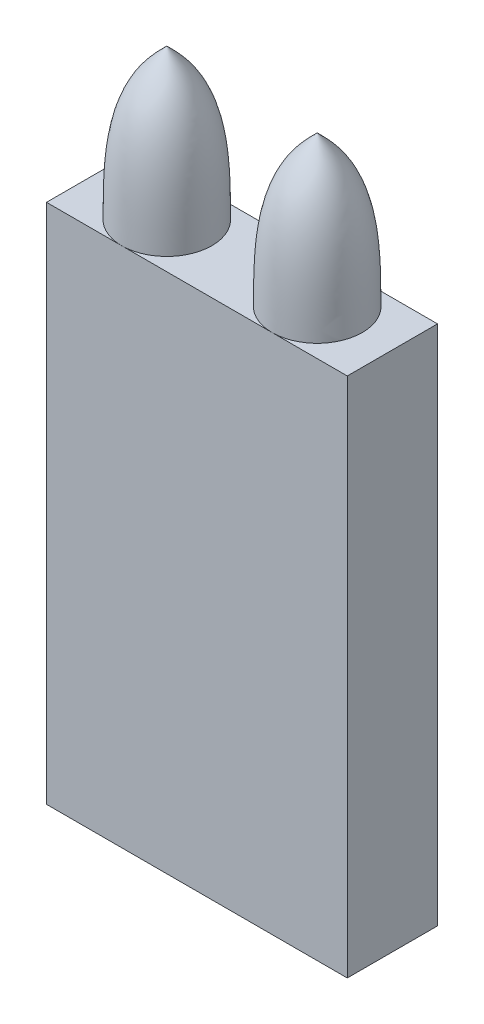
from build123d import *

# Parameters (mm, degrees)
EXTRUSION1_DEPTH        = 3
ESQUISSE4_W             = 20
ESQUISSE4_H             = 34.667192899
EXTRUSION2_DEPTH        = 3
ENL_V_MAT_EXTRU_1_DEPTH = 2


with BuildPart() as part:
    # Esquisse1 → Révolution1 (revolve)
    with BuildSketch(Plane.XY):
        with BuildLine():
            Line((2, -0.332807101), (5, -0.332807101))
            Line((5, -0.332807101), (5, 9.667192899))
            add(Edge.make_bspline(
                [(2, -0.332807101), (2.010323588, 2.856708429), (2.022748068, 6.695303328), (4.569382114, 9.237350604), (5, 9.667192899)],
                knots=[0, 0, 0, 0, 0.830907041, 1, 1, 1, 1], degree=3))
        make_face()
    revolve(axis=Axis((5, 9.667192899, 0), (0, -1, 0)))



with BuildPart() as body_2:
    # Esquisse2 → Révolution2 (revolve)
    with BuildSketch(Plane.XY):
        with BuildLine():
            Line((-5, -0.332807101), (-5, 9.667192899))
            add(Edge.make_bspline(
                [(-2, -0.332807101), (-2.010323588, 2.856708429), (-2.022748068, 6.695303328), (-4.569382114, 9.237350604), (-5, 9.667192899)],
                knots=[0, 0, 0, 0, 0.830907041, 1, 1, 1, 1], degree=3))
            Line((-2, -0.332807101), (-5, -0.332807101))
        make_face()
    revolve(axis=Axis((-5, -0.332807101, 0), (0, 1, 0)))


with BuildPart() as part_1:
    add(part.part)

    add(body_2.part)  # Extrusion1 merges body 2
    # Esquisse3 → Extrusion1 (add)
    with BuildSketch(Plane.XY):
        Polygon((-5, -0.332807101), (-10, -0.332807101), (-10, -35), (10, -35), (10, -0.332807101), (-2, -0.332807101), align=None)
    extrude(amount=EXTRUSION1_DEPTH)

    # Esquisse4 → Extrusion2 (add)
    with BuildSketch(Plane(origin=(0, 0, 0), x_dir=(-1, 0, 0), z_dir=(0, 0, -1))):
        with Locations((0, -17.666403551)):
            Rectangle(ESQUISSE4_W, ESQUISSE4_H)
    extrude(amount=EXTRUSION2_DEPTH)

    # Esquisse5 → Enlèv. mat.-Extru.1 (cut)
    # profile 1 of 7: a face of its own
    with BuildSketch(Plane(origin=(0, 0, -3), x_dir=(-1, 0, 0), z_dir=(0, 0, -1))):
        with BuildLine():
            Line((1.88205707, -4.609056191), (2.028591526, -4.306872698))
            add(Edge.make_bspline(
                [(2.028591526, -4.306872698), (2.0681298, -4.331373463), (2.145487617, -4.379309945), (2.250416066, -4.462110854), (2.344956523, -4.548975923), (2.426413726, -4.643310834), (2.498496553, -4.742379178), (2.560299916, -4.847857267), (2.614073444, -4.958711916), (2.657355003, -5.076502361), (2.691871735, -5.200757444), (2.717268928, -5.332449678), (2.731910041, -5.47227044), (2.733702877, -5.568156321), (2.734621173, -5.617269332)],
                knots=[0, 0, 0, 0, 1.069570816, 2.092647344, 3.070569067, 4.01967349, 4.95558248, 5.886223065, 6.829136365, 7.787158173, 8.769682878, 9.793833117, 10.86999526, 12, 12, 12, 12], degree=3))
            add(Edge.make_bspline(
                [(2.734621173, -5.617269332), (2.733491292, -5.671783429), (2.731292178, -5.777885567), (2.711839409, -5.932507727), (2.68084433, -6.077976458), (2.636290994, -6.214443534), (2.579757917, -6.341928604), (2.509458812, -6.459967838), (2.427453669, -6.569328905), (2.332591272, -6.667321244), (2.23054515, -6.754879138), (2.124917796, -6.832794238), (2.014779553, -6.897174802), (1.902067393, -6.951374489), (1.785611939, -6.992567049), (1.665858567, -7.022086155), (1.543099313, -7.041237242), (1.459818742, -7.043109913), (1.417914442, -7.044052185)],
                knots=[0, 0, 0, 0, 1.205476757, 2.346249306, 3.441406768, 4.491003892, 5.516176455, 6.51984946, 7.52384197, 8.53303875, 9.530058913, 10.495883174, 11.432185487, 12.347937671, 13.258729326, 14.159013425, 15.073670464, 16, 16, 16, 16], degree=3))
            add(Edge.make_bspline(
                [(1.417914442, -7.044052185), (1.378597167, -7.043190644), (1.300588515, -7.041481278), (1.185417428, -7.025321948), (1.073118385, -7.000341878), (0.964345016, -6.964222501), (0.858485576, -6.918716444), (0.756667218, -6.861800599), (0.657022383, -6.796298361), (0.595262065, -6.744828256), (0.563948096, -6.718731672)],
                knots=[0, 0, 0, 0, 1.009393624, 2.002718548, 2.981368972, 3.96092115, 4.942292709, 5.936433579, 6.953722102, 8, 8, 8, 8], degree=3))
            add(Edge.make_bspline(
                [(0.563948096, -6.718731672), (0.525952755, -6.683794863), (0.450918732, -6.614800896), (0.353766595, -6.497790659), (0.271078852, -6.372293283), (0.203425772, -6.237740233), (0.151476958, -6.094315124), (0.114407866, -5.942481408), (0.09152986, -5.782025664), (0.088653882, -5.672033904), (0.087185276, -5.615867089)],
                knots=[0, 0, 0, 0, 0.997027178, 1.968950865, 2.931417886, 3.897315191, 4.873598335, 5.874141366, 6.914439499, 8, 8, 8, 8], degree=3))
            add(Edge.make_bspline(
                [(0.087185276, -5.615867089), (0.088531128, -5.55805062), (0.0911695, -5.44470887), (0.115847552, -5.27936872), (0.154507852, -5.122543072), (0.210653405, -4.975418159), (0.280603382, -4.836324828), (0.368922548, -4.707765343), (0.471111365, -4.586544415), (0.550428965, -4.515381412), (0.590590724, -4.479348659)],
                knots=[0, 0, 0, 0, 1.078704368, 2.114661124, 3.113565113, 4.088377923, 5.048374518, 6.012812246, 6.993805198, 8, 8, 8, 8], degree=3))
            add(Edge.make_bspline(
                [(0.590590724, -4.479348659), (0.620781565, -4.455165531), (0.680844897, -4.407054275), (0.778601978, -4.345133601), (0.881614061, -4.292483258), (0.990407479, -4.249605654), (1.10444175, -4.215870491), (1.224078523, -4.191582403), (1.349246493, -4.175582419), (1.434691553, -4.173379378), (1.478210917, -4.172257313)],
                knots=[0, 0, 0, 0, 0.967473567, 1.924745518, 2.889953502, 3.858752097, 4.846970718, 5.862117206, 6.911121386, 8, 8, 8, 8], degree=3))
            Line((1.478210917, -4.172257313), (1.478210917, -6.685077826))
            add(Edge.make_bspline(
                [(1.478210917, -6.685077826), (1.51191475, -6.683333135), (1.578247376, -6.679899402), (1.67544278, -6.664648075), (1.76761158, -6.639056219), (1.855064667, -6.605389547), (1.937854113, -6.562957175), (2.016020875, -6.511627525), (2.089287228, -6.450652885), (2.157372264, -6.381845306), (2.21899063, -6.306140886), (2.272893269, -6.225586172), (2.319099125, -6.140797294), (2.3561632, -6.051434132), (2.38509156, -5.957768694), (2.405115228, -5.859592401), (2.418220422, -5.757379491), (2.419745704, -5.687656243), (2.420518609, -5.652325422)],
                knots=[0, 0, 0, 0, 1.039073669, 2.045004336, 3.02296125, 3.980111893, 4.926619486, 5.882957722, 6.854402205, 7.857159866, 8.859995037, 9.85624635, 10.83864398, 11.829261994, 12.831114931, 13.853244543, 14.912175862, 16, 16, 16, 16], degree=3))
            add(Edge.make_bspline(
                [(2.420518609, -5.652325422), (2.419892101, -5.617706816), (2.418640001, -5.548520159), (2.407057975, -5.445619293), (2.388210983, -5.344107652), (2.361377653, -5.24545693), (2.329785404, -5.150894642), (2.292696476, -5.062884184), (2.250421202, -4.982468604), (2.202316592, -4.907096468), (2.143485893, -4.834110015), (2.070451647, -4.760744248), (1.982507372, -4.684222392), (1.916761094, -4.63502495), (1.88205707, -4.609056191)],
                knots=[0, 0, 0, 0, 1.015927462, 2.030371344, 3.035493238, 4.043957638, 5.028905753, 5.960363326, 6.844165366, 7.692896148, 8.581107265, 9.590178204, 10.727981024, 12, 12, 12, 12], degree=3))
        make_face()
        with BuildLine():
            add(Edge.make_bspline(
                [(1.164108353, -4.531231672), (1.122409741, -4.543870357), (1.042227853, -4.568173172), (0.931081245, -4.618254241), (0.832187123, -4.674941285), (0.746297664, -4.742505265), (0.671060746, -4.819223967), (0.604467086, -4.907122084), (0.54513787, -5.005776763), (0.494502241, -5.114695846), (0.453571134, -5.230227521), (0.422858807, -5.350009944), (0.405261409, -5.473250595), (0.402618424, -5.556452076), (0.40128784, -5.598339044)],
                knots=[0, 0, 0, 0, 1.104651615, 2.124124779, 3.086357996, 3.990392669, 4.887867225, 5.805973849, 6.782394871, 7.803867138, 8.848693862, 9.888661684, 10.937067484, 12, 12, 12, 12], degree=3))
            add(Edge.make_bspline(
                [(0.40128784, -5.598339044), (0.401897646, -5.632491635), (0.403103956, -5.70005174), (0.414595469, -5.799482813), (0.433286088, -5.895245363), (0.460427641, -5.987005398), (0.493850507, -6.075294278), (0.534685043, -6.160246701), (0.583892646, -6.241025667), (0.621946937, -6.291581536), (0.641071494, -6.316988884)],
                knots=[0, 0, 0, 0, 1.060669213, 2.098198702, 3.104911882, 4.088287873, 5.067258181, 6.03496313, 7.012451476, 8, 8, 8, 8], degree=3))
            add(Edge.make_bspline(
                [(0.641071494, -6.316988884), (0.656143822, -6.33507993), (0.686572171, -6.371602535), (0.739277608, -6.420908966), (0.795796396, -6.468726738), (0.859569632, -6.510767828), (0.927534959, -6.551302021), (1.001522365, -6.587143985), (1.08012954, -6.621716948), (1.135654097, -6.639967758), (1.164108353, -6.649320614)],
                knots=[0, 0, 0, 0, 0.898062514, 1.813028429, 2.750892972, 3.72092503, 4.724711932, 5.770102147, 6.857260878, 8, 8, 8, 8], degree=3))
            Line((1.164108353, -6.649320614), (1.164108353, -4.531231672))
        make_face(mode=Mode.SUBTRACT)
    # profile 2 of 7: a face of its own
    with BuildSketch(Plane(origin=(0, 0, -3), x_dir=(-1, 0, 0), z_dir=(0, 0, -1))):
        with BuildLine():
            Line((0.13205707, -9.251744493), (0.13205707, -8.892770134))
            Line((0.13205707, -8.892770134), (0.508559474, -8.892770134))
            add(Edge.make_bspline(
                [(0.508559474, -8.892770134), (0.473462064, -8.86724118), (0.406105942, -8.81824807), (0.316979215, -8.737208068), (0.243522785, -8.653723678), (0.184986047, -8.568015569), (0.141045779, -8.480110681), (0.109965932, -8.39056821), (0.090953103, -8.299017491), (0.088443476, -8.237309288), (0.087185276, -8.206371897)],
                knots=[0, 0, 0, 0, 1.240090001, 2.379880825, 3.435825918, 4.412439249, 5.338731203, 6.236759833, 7.116000016, 8, 8, 8, 8], degree=3))
            add(Edge.make_bspline(
                [(0.087185276, -8.206371897), (0.088382944, -8.182451734), (0.090850311, -8.1331728), (0.107928294, -8.058446223), (0.135317828, -7.981384586), (0.161331522, -7.931478321), (0.1748255, -7.905590647)],
                knots=[0, 0, 0, 0, 0.906785846, 1.868107758, 2.894132143, 4, 4, 4, 4], degree=3))
            Line((0.1748255, -7.905590647), (0.446860756, -8.092790166))
            add(Edge.make_bspline(
                [(0.446860756, -8.092790166), (0.440127235, -8.109544796), (0.42735683, -8.14132065), (0.412083476, -8.187690861), (0.403287287, -8.230342591), (0.401922961, -8.257521601), (0.40128784, -8.27017398)],
                knots=[0, 0, 0, 0, 1.175706723, 2.229776724, 3.175925307, 4, 4, 4, 4], degree=3))
            add(Edge.make_bspline(
                [(0.40128784, -8.27017398), (0.402941007, -8.297942223), (0.40630037, -8.354369438), (0.433307345, -8.437226321), (0.475411105, -8.518641505), (0.524330118, -8.582485638), (0.570588839, -8.632417062), (0.612096469, -8.667305538), (0.65700705, -8.701177363), (0.707700495, -8.730849674), (0.761644911, -8.760370004), (0.821374547, -8.785579836), (0.885161587, -8.809679237), (0.929617701, -8.823365766), (0.95236957, -8.830370294)],
                knots=[0, 0, 0, 0, 1.183164879, 2.404282402, 3.684748724, 5.08130077, 5.822236575, 6.586118212, 7.392150472, 8.220166419, 9.090371106, 10.015126268, 10.984176003, 12, 12, 12, 12], degree=3))
            add(Edge.make_bspline(
                [(0.95236957, -8.830370294), (0.972637317, -8.835581889), (1.017699976, -8.847169181), (1.093071363, -8.858768449), (1.182187828, -8.869141001), (1.284797412, -8.87840728), (1.401751288, -8.884109003), (1.532168701, -8.888924741), (1.67660614, -8.89282459), (1.777353304, -8.892788864), (1.830174058, -8.892770134)],
                knots=[0, 0, 0, 0, 0.569198417, 1.265537535, 2.072538121, 3.011085978, 4.068372936, 5.258499352, 6.562658, 8, 8, 8, 8], degree=3))
            Line((1.830174058, -8.892770134), (2.689749378, -8.892770134))
            Line((2.689749378, -8.892770134), (2.689749378, -9.251744493))
            Line((2.689749378, -9.251744493), (0.13205707, -9.251744493))
        make_face()
    # profile 3 of 7: a face of its own
    with BuildSketch(Plane(origin=(0, 0, -3), x_dir=(-1, 0, 0), z_dir=(0, 0, -1))):
        with BuildLine():
            Line((0.13205707, -12.985077826), (0.13205707, -12.626103467))
            Line((0.13205707, -12.626103467), (1.318355147, -12.626103467))
            add(Edge.make_bspline(
                [(1.318355147, -12.626103467), (1.353181138, -12.626077993), (1.41980764, -12.626029259), (1.515616277, -12.622669297), (1.603074371, -12.619698798), (1.682150909, -12.614361733), (1.752655554, -12.606144412), (1.814802991, -12.598486468), (1.868653754, -12.588009158), (1.901265126, -12.579072405), (1.916412038, -12.574921576)],
                knots=[0, 0, 0, 0, 1.388489964, 2.656355995, 3.822101815, 4.877729551, 5.815201774, 6.652054204, 7.373923399, 8, 8, 8, 8], degree=3))
            add(Edge.make_bspline(
                [(1.916412038, -12.574921576), (1.935491961, -12.568282859), (1.973442237, -12.555078344), (2.027274264, -12.528849252), (2.07813281, -12.498525025), (2.125943295, -12.463991951), (2.170982591, -12.425522929), (2.212400227, -12.382273657), (2.251373588, -12.335285188), (2.297802599, -12.265678552), (2.347669345, -12.170466286), (2.390245869, -12.045701226), (2.416122945, -11.910385795), (2.419022035, -11.816894017), (2.420518609, -11.768631512)],
                knots=[0, 0, 0, 0, 0.713237362, 1.418640674, 2.111118503, 2.803202376, 3.499999032, 4.200747446, 4.916513603, 5.65395606, 7.153437646, 8.699331164, 10.2961224, 12, 12, 12, 12], degree=3))
            add(Edge.make_bspline(
                [(2.420518609, -11.768631512), (2.418945318, -11.720615715), (2.415899388, -11.627655972), (2.391283959, -11.493912268), (2.349579699, -11.371551559), (2.292172146, -11.261495533), (2.221426021, -11.164690385), (2.138458626, -11.084140193), (2.045627033, -11.018126954), (1.976422419, -10.988929828), (1.941652423, -10.974260518)],
                knots=[0, 0, 0, 0, 1.164572994, 2.25464146, 3.285868583, 4.290364298, 5.255624302, 6.182035225, 7.08661253, 8, 8, 8, 8], degree=3))
            add(Edge.make_bspline(
                [(1.941652423, -10.974260518), (1.927701798, -10.969778754), (1.89693587, -10.959894923), (1.844408964, -10.950201565), (1.781972498, -10.941141857), (1.709007174, -10.933450976), (1.625728145, -10.928249471), (1.532229647, -10.924092036), (1.428683499, -10.921135818), (1.356217972, -10.921030362), (1.318355147, -10.920975262)],
                knots=[0, 0, 0, 0, 0.559844265, 1.234649207, 2.038502869, 2.973158959, 4.039089416, 5.228949391, 6.552141825, 8, 8, 8, 8], degree=3))
            Line((1.318355147, -10.920975262), (0.13205707, -10.920975262))
            Line((0.13205707, -10.920975262), (0.13205707, -10.562000903))
            Line((0.13205707, -10.562000903), (1.377249378, -10.562000903))
            add(Edge.make_bspline(
                [(1.377249378, -10.562000903), (1.419558633, -10.562378929), (1.501656047, -10.563112454), (1.620944658, -10.569488372), (1.732309904, -10.579786319), (1.835564016, -10.594251122), (1.930284334, -10.613303618), (2.017235257, -10.635228191), (2.095942103, -10.662683628), (2.167557144, -10.694240043), (2.232579828, -10.730944399), (2.294299635, -10.76994152), (2.351371002, -10.814532667), (2.406089431, -10.861932163), (2.455653698, -10.915266617), (2.502666049, -10.971613566), (2.54578974, -11.032561727), (2.585000661, -11.097668535), (2.620031425, -11.167319205), (2.651037137, -11.241004104), (2.676822408, -11.318879961), (2.697941225, -11.401129243), (2.714640008, -11.487515906), (2.726466986, -11.578357948), (2.733627533, -11.67316161), (2.734285467, -11.737769295), (2.734621173, -11.770734877)],
                knots=[0, 0, 0, 0, 1.455489344, 2.824249936, 4.108329657, 5.302249325, 6.409182103, 7.431056236, 8.384600105, 9.273623122, 10.119381909, 10.951268541, 11.782688782, 12.608648331, 13.439018233, 14.28420356, 15.13194734, 16.004789275, 16.896534964, 17.811891032, 18.752637364, 19.715994979, 20.73149136, 21.777654197, 22.866064894, 24, 24, 24, 24], degree=3))
            add(Edge.make_bspline(
                [(2.734621173, -11.770734877), (2.734296303, -11.803935241), (2.733661799, -11.868778746), (2.726386693, -11.964034104), (2.714827472, -12.054922311), (2.697637784, -12.141673762), (2.676939326, -12.224475971), (2.651192232, -12.303096199), (2.61982851, -12.377087721), (2.585214715, -12.447180137), (2.545468087, -12.512831346), (2.502251652, -12.574123173), (2.455732123, -12.631601942), (2.405059642, -12.684355247), (2.350254799, -12.732667856), (2.291923375, -12.776993329), (2.230008822, -12.816990329), (2.163973919, -12.853407529), (2.091700589, -12.885477048), (2.010908917, -12.911565322), (1.922292036, -12.934870784), (1.824694553, -12.952548558), (1.719228636, -12.967320814), (1.605047723, -12.97762796), (1.482490654, -12.983970038), (1.397823866, -12.984700635), (1.354112359, -12.985077826)],
                knots=[0, 0, 0, 0, 1.127311838, 2.201748491, 3.242349228, 4.23701642, 5.203382164, 6.139583413, 7.043187276, 7.930575844, 8.79221141, 9.646615004, 10.475912738, 11.301098226, 12.127656736, 12.954710499, 13.786889854, 14.628740568, 15.513605364, 16.467372646, 17.508850825, 18.623433476, 19.833461899, 21.124763205, 22.515581664, 24, 24, 24, 24], degree=3))
            Line((1.354112359, -12.985077826), (0.13205707, -12.985077826))
        make_face()
    # profile 4 of 7: a face of its own
    with BuildSketch(Plane(origin=(0, 0, -3), x_dir=(-1, 0, 0), z_dir=(0, 0, -1))):
        Polygon((-0.899994212, -15.058154749), (-0.899994212, -14.69918039), (0.13205707, -14.69918039), (0.13205707, -14.205590647), (0.446159635, -14.205590647), (0.446159635, -14.69918039), (2.689749378, -14.69918039), (2.689749378, -15.058154749), (0.446159635, -15.058154749), (0.446159635, -15.551744493), (0.13205707, -15.551744493), (0.13205707, -15.058154749), align=None)
    # profile 5 of 7: a face of its own
    with BuildSketch(Plane(origin=(0, 0, -3), x_dir=(-1, 0, 0), z_dir=(0, 0, -1))):
        with BuildLine():
            Line((0.13205707, -19.59918039), (0.13205707, -19.240206031))
            Line((0.13205707, -19.240206031), (0.605314282, -19.240206031))
            add(Edge.make_bspline(
                [(0.605314282, -19.240206031), (0.56259977, -19.204227131), (0.478848043, -19.133682134), (0.370497437, -19.013739127), (0.280619158, -18.885720489), (0.20803034, -18.750001006), (0.154609271, -18.60550218), (0.114804482, -18.453922135), (0.091476677, -18.293948428), (0.088633713, -18.184625834), (0.087185276, -18.128927986)],
                knots=[0, 0, 0, 0, 1.052649639, 2.063964259, 3.038813347, 3.997354988, 4.95870115, 5.938234768, 6.949568608, 8, 8, 8, 8], degree=3))
            add(Edge.make_bspline(
                [(0.087185276, -18.128927986), (0.088495318, -18.08003455), (0.091080006, -17.983568807), (0.108605694, -17.841728218), (0.13876178, -17.705257957), (0.182154548, -17.574598322), (0.235590372, -17.448425762), (0.303226698, -17.328688478), (0.381822509, -17.213990142), (0.471845954, -17.106378354), (0.569563196, -17.007183399), (0.674299756, -16.920752625), (0.783733814, -16.847243081), (0.897739474, -16.786063365), (1.017540143, -16.739894372), (1.142145659, -16.706954846), (1.27135048, -16.685678393), (1.359404195, -16.683575951), (1.403892006, -16.682513723)],
                knots=[0, 0, 0, 0, 1.079831048, 2.130484411, 3.151152415, 4.161574847, 5.167411663, 6.172652272, 7.193516047, 8.234449481, 9.267404425, 10.26472832, 11.228230131, 12.174979933, 13.116310661, 14.056636003, 15.018144646, 16, 16, 16, 16], degree=3))
            add(Edge.make_bspline(
                [(1.403892006, -16.682513723), (1.449303842, -16.68364121), (1.538929365, -16.685866436), (1.670570815, -16.706075754), (1.797085117, -16.738999782), (1.918194055, -16.785792628), (2.034562117, -16.844742497), (2.145188858, -16.917561245), (2.25013397, -17.00388485), (2.348571984, -17.102100958), (2.438990555, -17.208822956), (2.51837684, -17.322537598), (2.584862855, -17.442042311), (2.640224809, -17.566691122), (2.682092816, -17.697017368), (2.71235769, -17.832633928), (2.730944277, -17.97369931), (2.733384612, -18.069743759), (2.734621173, -18.118411159)],
                knots=[0, 0, 0, 0, 1.000386672, 1.974379078, 2.927679124, 3.87665516, 4.830386529, 5.797612976, 6.789582816, 7.820380598, 8.858501418, 9.868759178, 10.871900501, 11.868247445, 12.870065362, 13.883574667, 14.927570307, 16, 16, 16, 16], degree=3))
            add(Edge.make_bspline(
                [(2.734621173, -18.118411159), (2.73324635, -18.173188592), (2.730541852, -18.280944639), (2.705981212, -18.438939881), (2.666031896, -18.590165347), (2.609549834, -18.734450936), (2.537547181, -18.872345616), (2.449210477, -19.002932048), (2.346003029, -19.127440087), (2.266636176, -19.202212353), (2.226307872, -19.240206031)],
                knots=[0, 0, 0, 0, 1.033846792, 2.033743403, 3.011111982, 3.982283235, 4.953494596, 5.942511426, 6.954538061, 8, 8, 8, 8], degree=3))
            Line((2.226307872, -19.240206031), (3.63205707, -19.240206031))
            Line((3.63205707, -19.240206031), (3.63205707, -19.59918039))
            Line((3.63205707, -19.59918039), (0.13205707, -19.59918039))
        make_face()
        with BuildLine():
            add(Edge.make_bspline(
                [(0.40128784, -18.1422493), (0.401920936, -18.180163007), (0.403164377, -18.254627847), (0.41816442, -18.363825493), (0.439911553, -18.468975244), (0.472633901, -18.569240634), (0.513210316, -18.665215064), (0.563351625, -18.756476069), (0.623496749, -18.842556201), (0.690669975, -18.924312068), (0.76538758, -18.997981781), (0.844668595, -19.063403895), (0.929651081, -19.117231584), (1.018020723, -19.162841839), (1.111693265, -19.197022996), (1.209250797, -19.222564484), (1.311587608, -19.237442274), (1.381175041, -19.239275236), (1.416512199, -19.240206031)],
                knots=[0, 0, 0, 0, 1.089869178, 2.140569769, 3.165134853, 4.175037148, 5.169038028, 6.158983698, 7.164153224, 8.185913181, 9.198497231, 10.178139172, 11.136700046, 12.086806939, 13.033410836, 13.998737774, 14.983740093, 16, 16, 16, 16], degree=3))
            add(Edge.make_bspline(
                [(1.416512199, -19.240206031), (1.462905925, -19.238409598), (1.553869434, -19.234887357), (1.686713366, -19.208427314), (1.812003696, -19.163789612), (1.929596915, -19.101739627), (2.037969158, -19.023339794), (2.133932601, -18.927825938), (2.218905741, -18.818221397), (2.290121265, -18.694516582), (2.347712104, -18.561758222), (2.390417714, -18.423656127), (2.415513545, -18.281519101), (2.418843966, -18.185581823), (2.420518609, -18.137341448)],
                knots=[0, 0, 0, 0, 1.004072475, 1.968670389, 2.919364618, 3.874559533, 4.83812163, 5.804231433, 6.796142524, 7.832404746, 8.886210388, 9.923435828, 10.95583619, 12, 12, 12, 12], degree=3))
            add(Edge.make_bspline(
                [(2.420518609, -18.137341448), (2.418929759, -18.090016502), (2.4157685, -17.995856285), (2.389515827, -17.857447565), (2.348048632, -17.723047652), (2.289013899, -17.59499083), (2.216233253, -17.47453585), (2.12830504, -17.365960483), (2.02668994, -17.270888088), (1.913296692, -17.190041737), (1.792601308, -17.124307497), (1.666911558, -17.076856335), (1.538329628, -17.046360349), (1.451033254, -17.04311186), (1.407397615, -17.041488082)],
                knots=[0, 0, 0, 0, 1.02979818, 2.048940961, 3.056544965, 4.085890364, 5.111416942, 6.113647569, 7.118149602, 8.132133424, 9.138580134, 10.101713523, 11.051129621, 12, 12, 12, 12], degree=3))
            add(Edge.make_bspline(
                [(1.407397615, -17.041488082), (1.363540471, -17.043163591), (1.276085312, -17.046504708), (1.146901569, -17.076072737), (1.021453783, -17.12328829), (0.901484513, -17.188632358), (0.789505234, -17.268809631), (0.689206849, -17.363147809), (0.602897547, -17.471300872), (0.530271669, -17.590735775), (0.473037839, -17.71978067), (0.431210728, -17.855483709), (0.406210367, -17.99713076), (0.402940106, -18.093539687), (0.40128784, -18.1422493)],
                knots=[0, 0, 0, 0, 0.952525979, 1.899423946, 2.865876581, 3.859467237, 4.860720726, 5.852841987, 6.843244024, 7.860259403, 8.883892529, 9.904557406, 10.941299304, 12, 12, 12, 12], degree=3))
        make_face(mode=Mode.SUBTRACT)
    # profile 6 of 7: a face of its own
    with BuildSketch(Plane(origin=(0, 0, -3), x_dir=(-1, 0, 0), z_dir=(0, 0, -1))):
        with BuildLine():
            Line((0.13205707, -21.044052185), (2.689749378, -21.044052185))
            Line((2.689749378, -21.044052185), (2.689749378, -21.403026544))
            Line((2.689749378, -21.403026544), (2.247341526, -21.403026544))
            add(Edge.make_bspline(
                [(2.247341526, -21.403026544), (2.287467278, -21.440990709), (2.366466997, -21.515734689), (2.468181667, -21.64022883), (2.552464364, -21.771965611), (2.620186258, -21.910061208), (2.671605348, -22.055119862), (2.70757483, -22.206525707), (2.731151802, -22.364227076), (2.733453129, -22.471683774), (2.734621173, -22.526223659)],
                knots=[0, 0, 0, 0, 1.048315161, 2.063926512, 3.044028115, 4.012756489, 4.978653777, 5.96048261, 6.964838411, 8, 8, 8, 8], degree=3))
            add(Edge.make_bspline(
                [(2.734621173, -22.526223659), (2.73340509, -22.574894502), (2.731010961, -22.670713911), (2.71216779, -22.811728692), (2.6823477, -22.9472206), (2.640052841, -23.077421817), (2.58488262, -23.20189564), (2.518380004, -23.321403541), (2.43895733, -23.435076026), (2.348811505, -23.541841871), (2.249886848, -23.63933116), (2.145219662, -23.725702442), (2.034554077, -23.798481957), (1.918196184, -23.857442097), (1.797084546, -23.904232216), (1.670570971, -23.937156979), (1.538929325, -23.957366097), (1.449303829, -23.959591351), (1.403892006, -23.960718852)],
                knots=[0, 0, 0, 0, 1.073006613, 2.112452808, 3.131537238, 4.128992884, 5.125875819, 6.129556788, 7.140358021, 8.179037306, 9.206764687, 10.199268163, 11.167014935, 12.12125937, 13.070745913, 14.024558793, 14.999075164, 16, 16, 16, 16], degree=3))
            add(Edge.make_bspline(
                [(1.403892006, -23.960718852), (1.359403541, -23.959657861), (1.271348533, -23.957557866), (1.142153189, -23.936263481), (1.017512566, -23.903390383), (0.897944822, -23.857013085), (0.783533331, -23.796837524), (0.674330446, -23.72312283), (0.569554939, -23.636766579), (0.471846601, -23.537551572), (0.381828378, -23.429941951), (0.303203294, -23.315255041), (0.235782426, -23.195658067), (0.181988966, -23.069875122), (0.138782801, -22.939365953), (0.108671258, -22.803133962), (0.091038879, -22.661538663), (0.088483556, -22.565302561), (0.087185276, -22.516407954)],
                knots=[0, 0, 0, 0, 0.982608992, 1.944855656, 2.885902759, 3.827956019, 4.773021323, 5.737262684, 6.73535209, 7.769099895, 8.810832312, 9.832479667, 10.838491863, 11.840357401, 12.851555398, 13.873006831, 14.919340111, 16, 16, 16, 16], degree=3))
            add(Edge.make_bspline(
                [(0.087185276, -22.516407954), (0.088615347, -22.460239887), (0.091416704, -22.350212685), (0.114936785, -22.189122362), (0.15432441, -22.036714335), (0.208226825, -21.891688141), (0.280451734, -21.755575726), (0.370100972, -21.627487362), (0.479147859, -21.508849987), (0.562649975, -21.43881169), (0.605314282, -21.403026544)],
                knots=[0, 0, 0, 0, 1.057102752, 2.070750592, 3.056826284, 4.016232894, 4.976728547, 5.94961084, 6.952380656, 8, 8, 8, 8], degree=3))
            Line((0.605314282, -21.403026544), (0.13205707, -21.403026544))
            Line((0.13205707, -21.403026544), (0.13205707, -21.044052185))
        make_face()
        with BuildLine():
            add(Edge.make_bspline(
                [(0.40128784, -22.500983275), (0.40294012, -22.549692868), (0.406210411, -22.646101757), (0.431210557, -22.78774909), (0.473038468, -22.923451079), (0.530269316, -23.052499887), (0.602906167, -23.171920392), (0.689175584, -23.28012579), (0.789722824, -23.374362651), (0.901270359, -23.455333965), (1.021323914, -23.520799868), (1.147054341, -23.566973868), (1.276067176, -23.596778902), (1.363534413, -23.600086029), (1.407397615, -23.601744493)],
                knots=[0, 0, 0, 0, 1.058595202, 2.095233796, 3.115796969, 4.139328096, 5.156242136, 6.146545486, 7.138567887, 8.142695509, 9.13618716, 10.10076532, 11.047568934, 12, 12, 12, 12], degree=3))
            add(Edge.make_bspline(
                [(1.407397615, -23.601744493), (1.451039331, -23.600137713), (1.538347863, -23.59692323), (1.666757759, -23.566190095), (1.792733467, -23.519784378), (1.913511737, -23.453925165), (2.026465809, -23.37227924), (2.128361682, -23.277329363), (2.216003208, -23.168779879), (2.289186819, -23.048828151), (2.348333623, -22.920498717), (2.389279275, -22.785479945), (2.415897499, -22.64622588), (2.418967893, -22.551586044), (2.420518609, -22.503787762)],
                knots=[0, 0, 0, 0, 0.94754999, 1.89564494, 2.855650757, 3.860696959, 4.87623684, 5.879341071, 6.880177056, 7.899942424, 8.92785545, 9.943764016, 10.961488621, 12, 12, 12, 12], degree=3))
            add(Edge.make_bspline(
                [(2.420518609, -22.503787762), (2.418839401, -22.455548516), (2.415499903, -22.359613483), (2.390510555, -22.217680581), (2.347718107, -22.080050696), (2.289953672, -21.947853093), (2.218893554, -21.824329267), (2.134132781, -21.714741326), (2.037932739, -21.619859868), (1.929412385, -21.542196613), (1.811873425, -21.480303591), (1.686866083, -21.434604391), (1.553849693, -21.408402197), (1.462899257, -21.404842222), (1.416512199, -21.403026544)],
                knots=[0, 0, 0, 0, 1.045407845, 2.079038228, 3.112656195, 4.163072846, 5.20056969, 6.193662562, 7.157374447, 8.119113477, 9.075446429, 10.028984102, 10.994731255, 12, 12, 12, 12], degree=3))
            add(Edge.make_bspline(
                [(1.416512199, -21.403026544), (1.381174839, -21.403957029), (1.311587007, -21.40578938), (1.209253094, -21.420671613), (1.111684904, -21.446196756), (1.018051333, -21.480437682), (0.929422786, -21.525882249), (0.844896977, -21.580644684), (0.765321992, -21.64587294), (0.690928899, -21.719610736), (0.62326306, -21.800713348), (0.563385882, -21.886785456), (0.51320116, -21.978009773), (0.472636401, -22.073994054), (0.439910868, -22.174256752), (0.418164609, -22.279407242), (0.403164327, -22.388604686), (0.40192092, -22.463069554), (0.40128784, -22.500983275)],
                knots=[0, 0, 0, 0, 1.016356408, 2.00145226, 2.966870863, 3.913564647, 4.863761759, 5.826061372, 6.805796337, 7.818476539, 8.835166489, 9.840431463, 10.830471135, 11.824566403, 12.834564595, 13.859226969, 14.910027331, 16, 16, 16, 16], degree=3))
        make_face(mode=Mode.SUBTRACT)
    # profile 7 of 7: a face of its own
    with BuildSketch(Plane(origin=(0, 0, -3), x_dir=(-1, 0, 0), z_dir=(0, 0, -1))):
        with BuildLine():
            Line((-0.168023058, -25.181231672), (0.042313481, -25.479208435))
            add(Edge.make_bspline(
                [(0.042313481, -25.479208435), (0.018920036, -25.499730921), (-0.027709905, -25.540638206), (-0.092925216, -25.606812984), (-0.153531766, -25.676248699), (-0.211030662, -25.747697879), (-0.262702906, -25.823392086), (-0.311273672, -25.901446649), (-0.354568893, -25.983176723), (-0.394115058, -26.067233191), (-0.428209553, -26.154303797), (-0.458182391, -26.243263473), (-0.484820495, -26.334013769), (-0.504567522, -26.427428143), (-0.520801117, -26.522852639), (-0.53278099, -26.620387622), (-0.539979532, -26.720083417), (-0.54067093, -26.787256082), (-0.541019853, -26.82115555)],
                knots=[0, 0, 0, 0, 0.987893886, 1.969159884, 2.947193632, 3.913758184, 4.879182583, 5.855384673, 6.831445725, 7.814141752, 8.803567409, 9.798570934, 10.794459596, 11.804623025, 12.828189998, 13.867374661, 14.923745782, 16, 16, 16, 16], degree=3))
            add(Edge.make_bspline(
                [(-0.541019853, -26.82115555), (-0.540616961, -26.858340209), (-0.539817316, -26.932142963), (-0.529283814, -27.041409607), (-0.514101851, -27.148666723), (-0.492413278, -27.253839381), (-0.464055734, -27.356929686), (-0.430800129, -27.458410609), (-0.389603215, -27.557091859), (-0.343723951, -27.653757123), (-0.292073411, -27.746415004), (-0.235971794, -27.834285405), (-0.175611201, -27.916549339), (-0.110808046, -27.99324443), (-0.041920182, -28.064853042), (0.030672898, -28.131738393), (0.108502555, -28.192009938), (0.189451574, -28.247549607), (0.274418049, -28.296536267), (0.362267701, -28.339391138), (0.452799697, -28.376157909), (0.546260526, -28.405272334), (0.641724183, -28.428771342), (0.739973229, -28.444671934), (0.840680672, -28.454745891), (0.908876089, -28.456159875), (0.943254987, -28.456872698)],
                knots=[0, 0, 0, 0, 1.086665301, 2.156773686, 3.206091023, 4.252579737, 5.293432989, 6.330489748, 7.372149932, 8.417277294, 9.457143444, 10.471099767, 11.463182959, 12.437701567, 13.404115379, 14.366487576, 15.320456103, 16.279329637, 17.234398489, 18.184690068, 19.134957086, 20.087873006, 21.044016506, 22.006606947, 22.995084137, 24, 24, 24, 24], degree=3))
            add(Edge.make_bspline(
                [(0.943254987, -28.456872698), (0.99499839, -28.455722605), (1.096657695, -28.453463038), (1.245491321, -28.429777596), (1.388233981, -28.393961436), (1.523922097, -28.341471186), (1.65330446, -28.275164956), (1.776148651, -28.193940454), (1.891799275, -28.097322487), (1.999961619, -27.987607574), (2.098465504, -27.866808182), (2.184950278, -27.737115723), (2.257623834, -27.59905526), (2.317215317, -27.453733169), (2.363777207, -27.300684882), (2.396233752, -27.139852108), (2.417437557, -26.971528755), (2.419479944, -26.85651123), (2.420518609, -26.798018531)],
                knots=[0, 0, 0, 0, 0.99976017, 1.964210274, 2.906846164, 3.840961381, 4.770693628, 5.713253685, 6.682446088, 7.679475408, 8.688072431, 9.692042094, 10.688661653, 11.699927997, 12.724944829, 13.776981813, 14.869473725, 16, 16, 16, 16], degree=3))
            add(Edge.make_bspline(
                [(2.420518609, -26.798018531), (2.418825112, -26.733649441), (2.415490048, -26.606885064), (2.387398829, -26.420987492), (2.341881974, -26.243020111), (2.277646093, -26.073042661), (2.195289861, -25.910936264), (2.094140098, -25.757440703), (1.975229894, -25.611666168), (1.883724373, -25.523864021), (1.837185276, -25.479208435)],
                knots=[0, 0, 0, 0, 1.038396361, 2.044951526, 3.026548194, 3.9981884, 4.971488998, 5.954852223, 6.959851486, 8, 8, 8, 8], degree=3))
            Line((1.837185276, -25.479208435), (2.045418449, -25.181231672))
            add(Edge.make_bspline(
                [(2.045418449, -25.181231672), (2.073997703, -25.204725661), (2.131190994, -25.251742231), (2.211223241, -25.328145795), (2.28692572, -25.408385213), (2.356897858, -25.49338012), (2.422240145, -25.582545601), (2.482612573, -25.675970768), (2.538033632, -25.773610002), (2.588524233, -25.875125302), (2.633365882, -25.980503411), (2.67277886, -26.089022345), (2.705401542, -26.200843606), (2.733441315, -26.315302695), (2.752890501, -26.433322727), (2.768796217, -26.553910684), (2.778054485, -26.677746804), (2.77900941, -26.76131163), (2.779492968, -26.803627505)],
                knots=[0, 0, 0, 0, 0.96266716, 1.92650595, 2.877571957, 3.832443176, 4.78996518, 5.753400783, 6.725953281, 7.710737009, 8.702764713, 9.705274259, 10.713837205, 11.733347248, 12.77039989, 13.825194518, 14.898713694, 16, 16, 16, 16], degree=3))
            add(Edge.make_bspline(
                [(2.779492968, -26.803627505), (2.77923528, -26.843841122), (2.77872689, -26.923178014), (2.770311457, -27.040316768), (2.758869194, -27.154306659), (2.741609935, -27.265086785), (2.721373766, -27.372989662), (2.694009851, -27.477083269), (2.663456961, -27.578323574), (2.627724265, -27.676431299), (2.587055214, -27.771263638), (2.54126298, -27.862720599), (2.490829145, -27.950892585), (2.435925899, -28.036148495), (2.376417583, -28.118222688), (2.311746338, -28.196833848), (2.242194145, -28.272208182), (2.192454937, -28.319487904), (2.167413641, -28.343290967)],
                knots=[0, 0, 0, 0, 1.12996279, 2.229288031, 3.299236407, 4.348972409, 5.379544523, 6.383222714, 7.372264321, 8.350978576, 9.316108783, 10.27081116, 11.224043633, 12.169664212, 13.119586762, 14.071641678, 15.029164452, 16, 16, 16, 16], degree=3))
            add(Edge.make_bspline(
                [(2.167413641, -28.343290967), (2.123954978, -28.381118287), (2.03787464, -28.456044396), (1.897308622, -28.551750315), (1.7512074, -28.633901632), (1.597596965, -28.700044313), (1.437537176, -28.751998651), (1.270683507, -28.789254265), (1.097154625, -28.811222819), (0.979308717, -28.814288838), (0.919416846, -28.815847057)],
                knots=[0, 0, 0, 0, 1.010986273, 2.002501589, 2.979902392, 3.950429292, 4.934185285, 5.930851189, 6.948413268, 8, 8, 8, 8], degree=3))
            add(Edge.make_bspline(
                [(0.919416846, -28.815847057), (0.856456738, -28.814090133), (0.73253078, -28.810631935), (0.550553075, -28.783448927), (0.376478347, -28.738417041), (0.209775969, -28.67592933), (0.05126623, -28.594294313), (-0.100355944, -28.496075247), (-0.243022392, -28.378236459), (-0.377641896, -28.245273229), (-0.499931399, -28.098513607), (-0.607725954, -27.941345478), (-0.697147213, -27.774182359), (-0.772280158, -27.598996567), (-0.829825435, -27.414298954), (-0.870056838, -27.220566107), (-0.895258411, -27.017898966), (-0.898395945, -26.879657162), (-0.899994212, -26.80923648)],
                knots=[0, 0, 0, 0, 0.999296999, 1.966941306, 2.913707878, 3.849592556, 4.787189525, 5.739176877, 6.712191726, 7.719721435, 8.739252801, 9.740634947, 10.740090377, 11.744245983, 12.762905952, 13.805749245, 14.882243776, 16, 16, 16, 16], degree=3))
            add(Edge.make_bspline(
                [(-0.899994212, -26.80923648), (-0.899513833, -26.766452058), (-0.898562451, -26.68171819), (-0.889198925, -26.556037811), (-0.873769083, -26.433453407), (-0.852767715, -26.314100026), (-0.82617007, -26.197938869), (-0.793356025, -26.085023828), (-0.753704808, -25.975441228), (-0.70921477, -25.868976111), (-0.658493443, -25.766630759), (-0.603297957, -25.668388405), (-0.542881363, -25.574966058), (-0.477618764, -25.486398224), (-0.407357267, -25.403019181), (-0.332660973, -25.323911578), (-0.253033898, -25.249646776), (-0.196353958, -25.204031841), (-0.168023058, -25.181231672)],
                knots=[0, 0, 0, 0, 1.109929715, 2.198198142, 3.267705293, 4.314469344, 5.341177329, 6.358188055, 7.363233747, 8.363291588, 9.350397162, 10.325151833, 11.285542034, 12.235151806, 13.177688181, 14.112763497, 15.056683734, 16, 16, 16, 16], degree=3))
        make_face()
    extrude(amount=-ENL_V_MAT_EXTRU_1_DEPTH, mode=Mode.SUBTRACT)


solid = part_1.part
